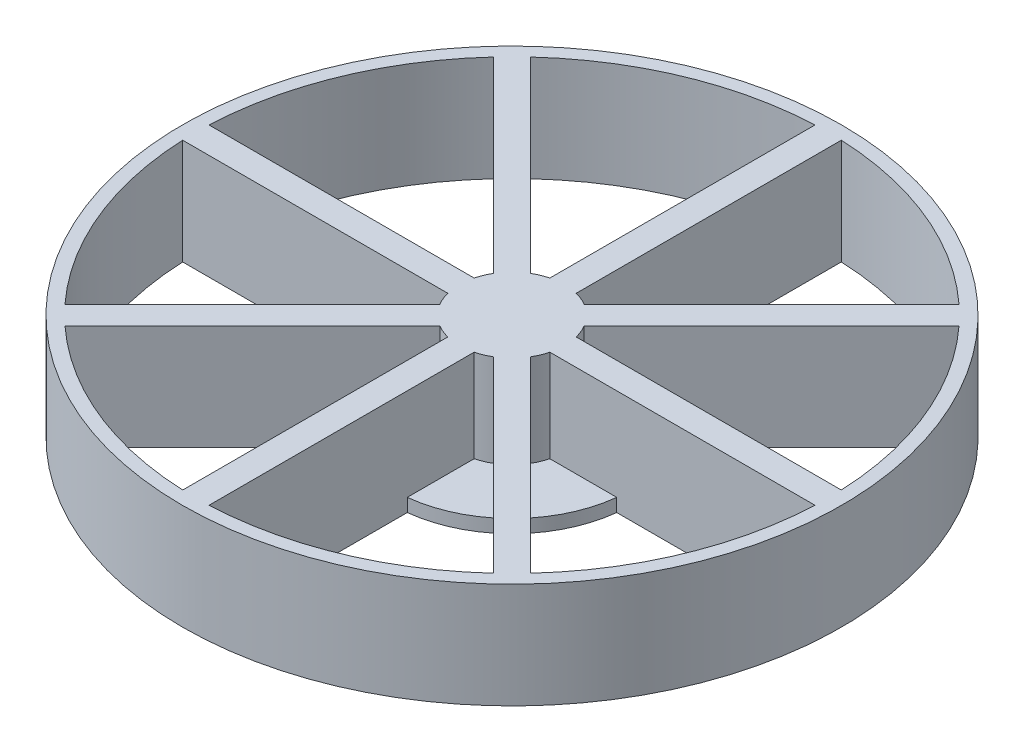
from build123d import *

# Parameters (mm, degrees)
SKETCH1_R           = 79.375
BOSS_EXTRUDE1_DEPTH = 25.4
SKETCH2_R           = 28.575
BOSS_EXTRUDE2_DEPTH = 3.175
SKETCH3_R           = 9.525
CUT_EXTRUDE1_DEPTH  = 19.05


with BuildPart() as part:
    # Sketch1 → Boss-Extrude1 (new body)
    with BuildSketch(Plane(origin=(0, 0, 0), x_dir=(1, 0, 0), z_dir=(0, 1, 0))):
        with Locations(Location((0, 0, 0), (0, 0, 270))):
            Circle(SKETCH1_R)
        with BuildLine():
            ThreePointArc((12.296722124, 3.175), (11.733270063, 4.860079591), (10.940159631, 6.45003157))
            Line((10.940159631, 6.45003157), (56.079808271, 51.589680211))
            ThreePointArc((56.079808271, 51.589680211), (70.399620377, 29.160477546), (76.133825433, 3.175))
            Line((76.133825433, 3.175), (12.296722124, 3.175))
        make_face(mode=Mode.SUBTRACT)
        with BuildLine():
            Line((51.589680211, 56.079808271), (6.45003157, 10.940159631))
            ThreePointArc((6.45003157, 10.940159631), (4.860079591, 11.733270063), (3.175, 12.296722124))
            Line((3.175, 12.296722124), (3.175, 76.133825433))
            ThreePointArc((3.175, 76.133825433), (29.160477546, 70.399620377), (51.589680211, 56.079808271))
        make_face(mode=Mode.SUBTRACT)
        with BuildLine():
            Line((-3.175, 76.133825433), (-3.175, 12.296722124))
            ThreePointArc((-3.175, 12.296722124), (-4.860079591, 11.733270063), (-6.45003157, 10.940159631))
            Line((-6.45003157, 10.940159631), (-51.589680211, 56.079808271))
            ThreePointArc((-51.589680211, 56.079808271), (-29.160477546, 70.399620377), (-3.175, 76.133825433))
        make_face(mode=Mode.SUBTRACT)
        with BuildLine():
            Line((-56.079808271, 51.589680211), (-10.940159631, 6.45003157))
            ThreePointArc((-10.940159631, 6.45003157), (-11.733270063, 4.860079591), (-12.296722124, 3.175))
            Line((-12.296722124, 3.175), (-76.133825433, 3.175))
            ThreePointArc((-76.133825433, 3.175), (-70.399620377, 29.160477546), (-56.079808271, 51.589680211))
        make_face(mode=Mode.SUBTRACT)
        with BuildLine():
            Line((-76.133825433, -3.175), (-12.296722124, -3.175))
            ThreePointArc((-12.296722124, -3.175), (-11.733270063, -4.860079591), (-10.940159631, -6.45003157))
            Line((-10.940159631, -6.45003157), (-56.079808271, -51.589680211))
            ThreePointArc((-56.079808271, -51.589680211), (-70.399620377, -29.160477546), (-76.133825433, -3.175))
        make_face(mode=Mode.SUBTRACT)
        with BuildLine():
            Line((-51.589680211, -56.079808271), (-6.45003157, -10.940159631))
            ThreePointArc((-6.45003157, -10.940159631), (-4.860079591, -11.733270063), (-3.175, -12.296722124))
            Line((-3.175, -12.296722124), (-3.175, -76.133825433))
            ThreePointArc((-3.175, -76.133825433), (-29.160477546, -70.399620377), (-51.589680211, -56.079808271))
        make_face(mode=Mode.SUBTRACT)
        with BuildLine():
            Line((3.175, -76.133825433), (3.175, -12.296722124))
            ThreePointArc((3.175, -12.296722124), (4.860079591, -11.733270063), (6.45003157, -10.940159631))
            Line((6.45003157, -10.940159631), (51.589680211, -56.079808271))
            ThreePointArc((51.589680211, -56.079808271), (29.160477546, -70.399620377), (3.175, -76.133825433))
        make_face(mode=Mode.SUBTRACT)
        with BuildLine():
            Line((56.079808271, -51.589680211), (10.940159631, -6.45003157))
            ThreePointArc((10.940159631, -6.45003157), (11.733270063, -4.860079591), (12.296722124, -3.175))
            Line((12.296722124, -3.175), (76.133825433, -3.175))
            ThreePointArc((76.133825433, -3.175), (70.399620377, -29.160477546), (56.079808271, -51.589680211))
        make_face(mode=Mode.SUBTRACT)
    extrude(amount=BOSS_EXTRUDE1_DEPTH)

    # Sketch2 → Boss-Extrude2 (add)
    with BuildSketch(Plane.XZ):
        Circle(SKETCH2_R)
    extrude(amount=-BOSS_EXTRUDE2_DEPTH)

    # Sketch3 → Cut-Extrude1 (cut)
    with BuildSketch(Plane.XZ):
        with Locations(Location((0, 0, 0), (0, 0, 270))):
            Circle(SKETCH3_R)
    extrude(amount=-CUT_EXTRUDE1_DEPTH, mode=Mode.SUBTRACT)


solid = part.part
